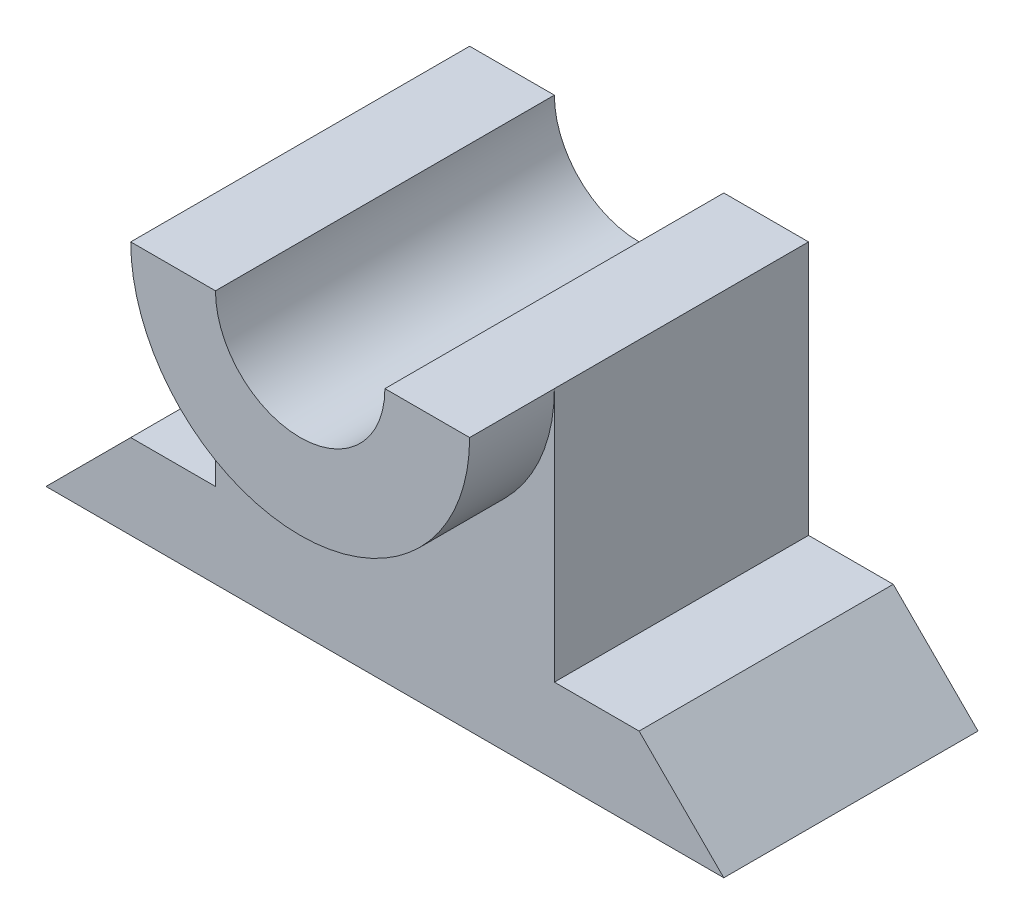
from build123d import *

# Parameters (mm, degrees)
BOSS_EXTRUDE1_DEPTH = 1016
BOSS_EXTRUDE2_DEPTH = 762


with BuildPart() as part:
    # Sketch1 → Boss-Extrude1 (new body)
    with BuildSketch(Plane.XY):
        with BuildLine():
            ThreePointArc((-508, 1016), (0, 508), (508, 1016))
            Line((508, 1016), (254, 1016))
            ThreePointArc((254, 1016), (0, 762), (-254, 1016))
            Line((-254, 1016), (-508, 1016))
        make_face()
    extrude(amount=BOSS_EXTRUDE1_DEPTH)

    # Sketch1<3> → Boss-Extrude2 (add)
    with BuildSketch(Plane.XY):
        with BuildLine():
            Line((-1016, 0), (1016, 0))
            Line((1016, 0), (762, 254))
            Line((762, 254), (508, 254))
            Line((508, 254), (508, 1016))
            ThreePointArc((508, 1016), (0, 508), (-508, 1016))
            Line((-508, 1016), (-508, 254))
            Line((-508, 254), (-762, 254))
            Line((-762, 254), (-1016, 0))
        make_face()
    extrude(amount=BOSS_EXTRUDE2_DEPTH)


solid = part.part
